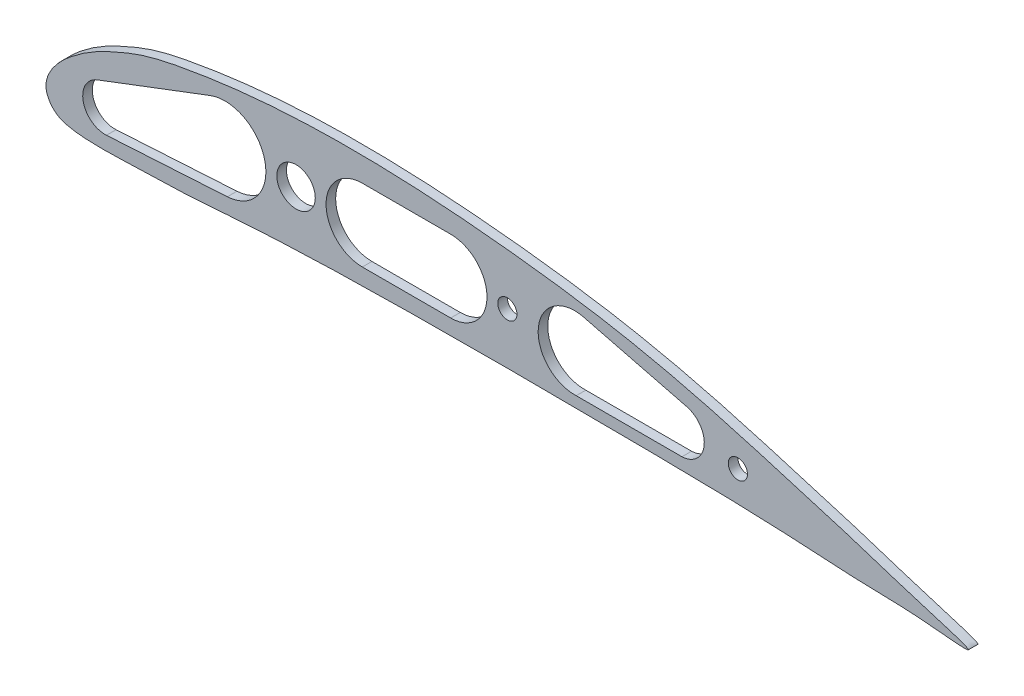
from build123d import *

# Parameters (mm, degrees)
BOSS_EXTRUDE1_DEPTH      = 1.5875
BOSS_EXTRUDE1_DEPTH_BACK = 1.5875
SKETCH1_R                = 6.35
SKETCH1_R_2              = 3.175
CUT_EXTRUDE1_DEPTH       = 83.312


with BuildPart() as part:
    # Sketch1 → Boss-Extrude1 (new, two sides: drawn at the far end of the back side and taken through both)
    with BuildSketch(Plane.XY.offset(-BOSS_EXTRUDE1_DEPTH_BACK)):
        with BuildLine():
            add(Edge.make_bspline(
                [(304.8, 0), (305.077640245, 0.670235949), (287.206651558, 5.720143468), (270.662795429, 11.397054489), (243.463273842, 19.4859206), (213.747912645, 28.209957225), (183.040246216, 34.676594881), (152.491946525, 38.62898995), (121.966980877, 41.172895409), (91.414928066, 41.723012749), (65.927495496, 40.062013506), (45.625003822, 37.00459991), (32.727710355, 34.352142796), (22.731795616, 30.196529044), (14.907225707, 26.461250588), (8.516283527, 21.964417846), (2.537455581, 16.488464455), (-1.964479894, 8.893906893), (2.841930098, 2.334923028), (8.778829491, 0.629027732), (15.228793663, 0.221834685), (22.863576464, 0.239109806), (33.015631673, 0.788100742), (45.740419078, 0.855312608), (66.018396979, 2.65839435), (91.426578086, 3.794926314), (121.91527013, 4.332217391), (152.40834867, 4.479066808), (182.849810214, 4.269103649), (213.479164171, 4.047670271), (243.430144592, 3.313971789), (270.486497521, 1.370513613), (287.394329759, 1.442404027), (304.536665057, -0.635702313), (304.8, 0)],
                knots=[0, 0, 0, 0, 0.025556044, 0.050960447, 0.101552747, 0.151805438, 0.201252492, 0.250083002, 0.298629141, 0.347026117, 0.395536064, 0.420002519, 0.444885368, 0.457915187, 0.471441031, 0.48620838, 0.494593531, 0.510948222, 0.521394631, 0.527823606, 0.539981828, 0.552079711, 0.564187269, 0.588393921, 0.612648894, 0.661100879, 0.709502089, 0.757894227, 0.806286364, 0.854680317, 0.903093621, 0.951545605, 0.97576072, 1, 1, 1, 1], degree=3))
        make_face()
        with Locations((82.55, 21.412200012)):
            Circle(SKETCH1_R, mode=Mode.SUBTRACT)
        with Locations((152.4, 21.412200012)):
            Circle(SKETCH1_R_2, mode=Mode.SUBTRACT)
        with Locations((228.6, 13.713637845)):
            Circle(SKETCH1_R_2, mode=Mode.SUBTRACT)
    extrude(amount=BOSS_EXTRUDE1_DEPTH + BOSS_EXTRUDE1_DEPTH_BACK)

    # Sketch2 → Cut-Extrude1 (cut)
    with BuildSketch(Plane.XY.offset(1.5875)):
        with BuildLine():
            Line((211.50265303, 23.10492457), (177.575712719, 31.649714976))
            ThreePointArc((177.575712719, 31.649714976), (162.64237396, 21.181283902), (175.164881599, 7.923099332))
            Line((175.164881599, 7.923099332), (210.11714063, 7.923099332))
            ThreePointArc((210.11714063, 7.923099332), (217.464748261, 14.906681868), (211.50265303, 23.10492457))
        make_face()
        with BuildLine():
            Line((133.6675, 33.406185449), (104.4575, 33.406185449))
            ThreePointArc((104.4575, 33.406185449), (92.463514563, 21.412200012), (104.4575, 9.418214575))
            Line((104.4575, 9.418214575), (133.6675, 9.418214575))
            ThreePointArc((133.6675, 9.418214575), (145.661485437, 21.412200012), (133.6675, 33.406185449))
        make_face()
        with BuildLine():
            ThreePointArc((16.804181612, 19.165884286), (12.188862773, 10.685302551), (19.873308784, 4.839729521))
            Line((19.873308784, 4.839729521), (59.832894927, 7.205034233))
            ThreePointArc((59.832894927, 7.205034233), (72.271895733, 23.557037644), (54.225767066, 33.378137212))
            Line((54.225767066, 33.378137212), (16.804181612, 19.165884286))
        make_face()
    extrude(amount=-CUT_EXTRUDE1_DEPTH, mode=Mode.SUBTRACT)


solid = part.part
